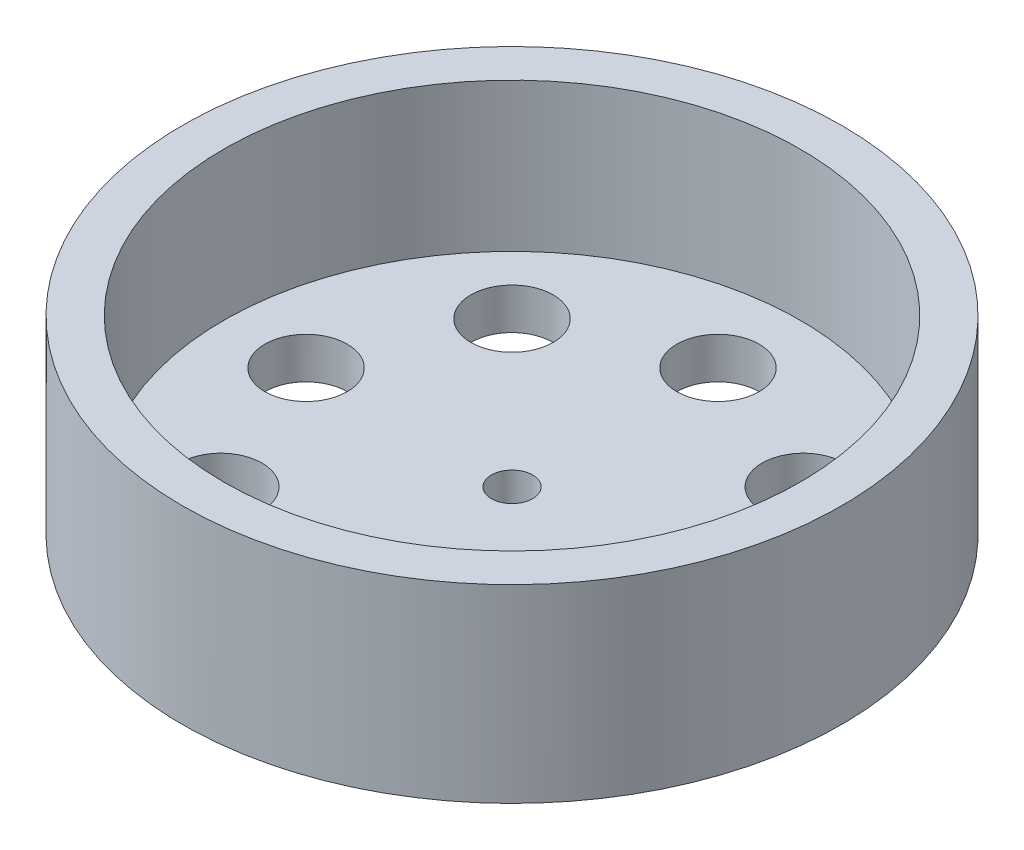
from build123d import *

# Parameters (mm, degrees)
ESQUISSE1_R             = 40
BOSS_EXTRU_2_DEPTH      = 35
ESQUISSE4_R             = 35
ENL_V_MAT_EXTRU_2_DEPTH = 18
ESQUISSE6_R             = 2.5
ENL_V_MAT_EXTRU_4_DEPTH = 12
ESQUISSE5_R             = 40
ENL_V_MAT_EXTRU_5_DEPTH = 12
ESQUISSE7_R             = 5
ENL_V_MAT_EXTRU_7_DEPTH = 10


with BuildPart() as part:
    # Esquisse1 → Boss.-Extru.2 (new body)
    with BuildSketch(Plane(origin=(0, 0, 0), x_dir=(1, 0, 0), z_dir=(0, 1, 0))):
        with Locations(Location((0, 0, 0), (0, 0, 270))):
            Circle(ESQUISSE1_R)
    extrude(amount=BOSS_EXTRU_2_DEPTH)

    # Esquisse4 → Enlèv. mat.-Extru.2 (cut)
    with BuildSketch(Plane(origin=(0, 35, 0), x_dir=(1, 0, 0), z_dir=(0, 1, 0))):
        with Locations(Location((0, 0, 0), (0, 0, 270))):
            Circle(ESQUISSE4_R)
    extrude(amount=-ENL_V_MAT_EXTRU_2_DEPTH, mode=Mode.SUBTRACT)

    # Esquisse6 → Enlèv. mat.-Extru.4 (cut)
    with BuildSketch(Plane(origin=(0, 17, 0), x_dir=(1, 0, 0), z_dir=(0, 1, 0))):
        with Locations(Location((0, 0, 0), (0, 0, 270))):
            Circle(ESQUISSE6_R)
    extrude(amount=-ENL_V_MAT_EXTRU_4_DEPTH, mode=Mode.SUBTRACT)

    # Esquisse5 → Enlèv. mat.-Extru.5 (cut)
    with BuildSketch(Plane(origin=(0, 0, 0), x_dir=(-1, 0, 0), z_dir=(0, -1, 0))):
        with Locations(Location((0, 0, 0), (0, 0, 90))):
            Circle(ESQUISSE5_R)
    extrude(amount=-ENL_V_MAT_EXTRU_5_DEPTH, mode=Mode.SUBTRACT)

    # Esquisse7 → Enlèv. mat.-Extru.7 (cut)
    with BuildSketch(Plane.XZ.offset(-12)):
        with Locations(Location((-25, 0, 0), (0, 0, 270))):
            Circle(ESQUISSE7_R)
        with Locations(Location((-17.67766953, 17.67766953, 0), (0, 0, 270))):
            Circle(ESQUISSE7_R)
        with Locations(Location((0, 25, 0), (0, 0, 270))):
            Circle(ESQUISSE7_R)
        with Locations(Location((17.67766953, 17.67766953, 0), (0, 0, 270))):
            Circle(ESQUISSE7_R)
        with Locations(Location((25, 0, 0), (0, 0, 270))):
            Circle(ESQUISSE7_R)
        with Locations(Location((17.67766953, -17.67766953, 0), (0, 0, 270))):
            Circle(ESQUISSE7_R)
        with Locations(Location((0, -25, 0), (0, 0, 270))):
            Circle(ESQUISSE7_R)
        with Locations(Location((-17.67766953, -17.67766953, 0), (0, 0, 270))):
            Circle(ESQUISSE7_R)
    extrude(amount=-ENL_V_MAT_EXTRU_7_DEPTH, mode=Mode.SUBTRACT)


solid = part.part
